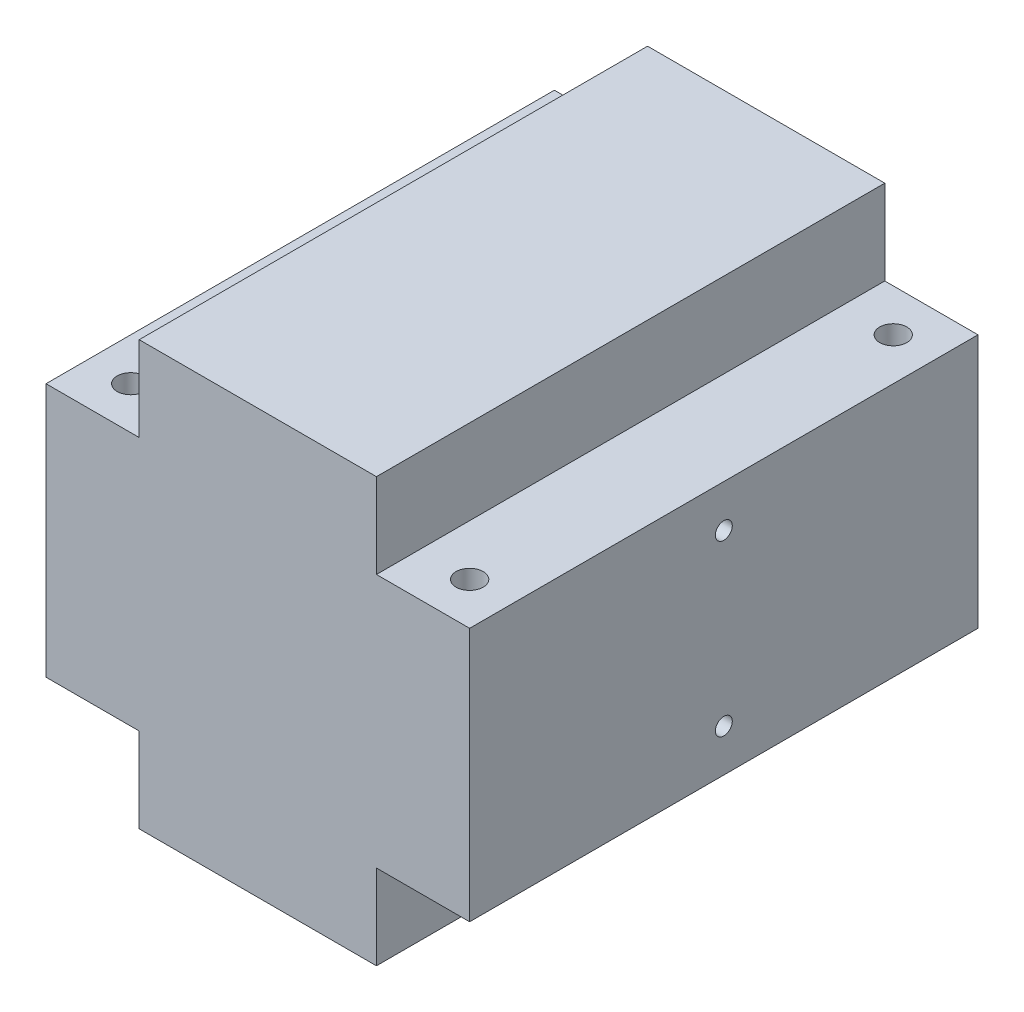
from build123d import *

# Parameters (mm, degrees)
BOSS_EXTRUDE1_DEPTH     = 600
M36_TAPPED_HOLE1_D      = 32
CUT_EXTRUDE1_DEPTH      = 928.36184955
CUT_EXTRUDE1_DEPTH_BACK = 100
SKETCH6_R               = 10
CUT_EXTRUDE2_START      = -100
SKETCH7_R               = 10
CUT_EXTRUDE2_DEPTH      = 100


with BuildPart() as part:
    # Sketch1 → Boss-Extrude1 (new body)
    with BuildSketch(Plane.XY):
        Polygon((110, 0), (390, 0), (390, 100), (500, 100), (500, 400), (390, 400), (390, 500), (110, 500), (110, 400), (0, 400), (0, 100), (110, 100), align=None)
    extrude(amount=BOSS_EXTRUDE1_DEPTH)

    # M36 Tapped Hole1 (through all)
    with Locations(Plane(origin=(0, 100, 0), x_dir=(-1, 0, 0), z_dir=(0, -1, 0))):
        with Locations((-50, -50), (-50, -550), (-450, -50), (-450, -550)):
            Hole(M36_TAPPED_HOLE1_D / 2)

    # Sketch6 → Cut-Extrude1 (cut, two sides: drawn at the far end of the back side and taken through both)
    with BuildSketch(Plane(origin=(500, 0, 0), x_dir=(0, 0, -1), z_dir=(1, 0, 0)).offset(-CUT_EXTRUDE1_DEPTH_BACK)):
        with Locations(Location((-300, 150, 0), (0, 0, 180))):
            Circle(SKETCH6_R)
        with Locations(Location((-300, 350, 0), (0, 0, 180))):
            Circle(SKETCH6_R)
    extrude(amount=CUT_EXTRUDE1_DEPTH + CUT_EXTRUDE1_DEPTH_BACK, mode=Mode.SUBTRACT)

    # Sketch7 → Cut-Extrude2 (cut)
    with BuildSketch(Plane.ZY.offset(CUT_EXTRUDE2_START)):
        with Locations((300, 150)):
            Circle(SKETCH7_R)
        with Locations((300, 350)):
            Circle(SKETCH7_R)
    extrude(amount=CUT_EXTRUDE2_DEPTH, mode=Mode.SUBTRACT)


solid = part.part
